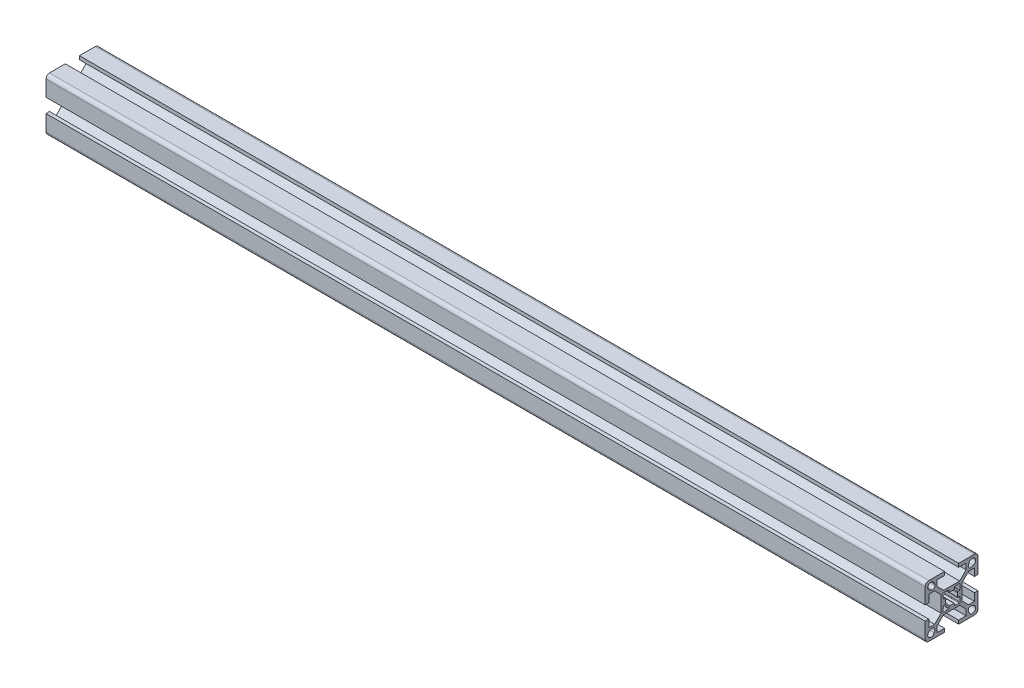
from build123d import *

# Parameters (mm, degrees)
BOSS_EXTRUDE1_DEPTH = 500


with BuildPart() as part:
    # Sketch1 → Boss-Extrude1 (new body)
    with BuildSketch(Plane(origin=(0, 0, 0), x_dir=(0, 0, -1), z_dir=(1, 0, 0))):
        with BuildLine():
            Line((-15, 13), (-15, 4))
            Line((-15, 4), (-13, 4))
            Line((-13, 4), (-13, 8.25))
            Line((-13, 8.25), (-9.664213562, 8.25))
            Line((-9.664213562, 8.25), (-6, 4.585786438))
            Line((-6, 4.585786438), (-6, -4.585786438))
            Line((-6, -4.585786438), (-9.664213562, -8.25))
            Line((-9.664213562, -8.25), (-13, -8.25))
            Line((-13, -8.25), (-13, -4))
            Line((-13, -4), (-15, -4))
            Line((-15, -4), (-15, -13))
            ThreePointArc((-15, -13), (-14.414213562, -14.414213562), (-13, -15))
            Line((-13, -15), (-4, -15))
            Line((-4, -15), (-4, -13))
            Line((-4, -13), (-8.25, -13))
            Line((-8.25, -13), (-8.25, -9.664213562))
            Line((-8.25, -9.664213562), (-4.585786438, -6))
            Line((-4.585786438, -6), (4.585786438, -6))
            Line((4.585786438, -6), (8.25, -9.664213562))
            Line((8.25, -9.664213562), (8.25, -13))
            Line((8.25, -13), (4, -13))
            Line((4, -13), (4, -15))
            Line((4, -15), (13, -15))
            ThreePointArc((13, -15), (14.414213562, -14.414213562), (15, -13))
            Line((15, -13), (15, -4))
            Line((15, -4), (13, -4))
            Line((13, -4), (13, -8.25))
            Line((13, -8.25), (9.664213562, -8.25))
            Line((9.664213562, -8.25), (6, -4.585786438))
            Line((6, -4.585786438), (6, 4.585786438))
            Line((6, 4.585786438), (9.664213562, 8.25))
            Line((9.664213562, 8.25), (13, 8.25))
            Line((13, 8.25), (13, 4))
            Line((13, 4), (15, 4))
            Line((15, 4), (15, 13))
            ThreePointArc((15, 13), (14.414213562, 14.414213562), (13, 15))
            Line((13, 15), (4, 15))
            Line((4, 15), (4, 13))
            Line((4, 13), (8.25, 13))
            Line((8.25, 13), (8.25, 9.664213562))
            Line((8.25, 9.664213562), (4.585786438, 6))
            Line((4.585786438, 6), (-4.585786438, 6))
            Line((-4.585786438, 6), (-8.25, 9.664213562))
            Line((-8.25, 9.664213562), (-8.25, 13))
            Line((-8.25, 13), (-4, 13))
            Line((-4, 13), (-4, 15))
            Line((-4, 15), (-13, 15))
            ThreePointArc((-13, 15), (-14.414213562, 14.414213562), (-15, 13))
        make_face()
        with BuildLine():
            Line((-9.539070071, 11.338915743), (-9.918883282, 12.361530981))
            ThreePointArc((-9.918883282, 12.361530981), (-13.043502884, 13.043502884), (-12.361530981, 9.918883282))
            Line((-12.361530981, 9.918883282), (-11.338915743, 9.539070071))
            ThreePointArc((-11.338915743, 9.539070071), (-9.861522369, 9.861522369), (-9.539070071, 11.338915743))
        make_face(mode=Mode.SUBTRACT)
        with BuildLine():
            Line((9.918883282, 12.361530981), (9.539070071, 11.338915743))
            ThreePointArc((9.539070071, 11.338915743), (9.861522369, 9.861522369), (11.338915743, 9.539070071))
            Line((11.338915743, 9.539070071), (12.361530981, 9.918883282))
            ThreePointArc((12.361530981, 9.918883282), (13.043502884, 13.043502884), (9.918883282, 12.361530981))
        make_face(mode=Mode.SUBTRACT)
        with BuildLine():
            Line((12.361530981, -9.918883282), (11.338915743, -9.539070071))
            ThreePointArc((11.338915743, -9.539070071), (9.861522369, -9.861522369), (9.539070071, -11.338915743))
            Line((9.539070071, -11.338915743), (9.918883282, -12.361530981))
            ThreePointArc((9.918883282, -12.361530981), (13.043502884, -13.043502884), (12.361530981, -9.918883282))
        make_face(mode=Mode.SUBTRACT)
        with BuildLine():
            Line((-11.338915743, -9.539070071), (-12.361530981, -9.918883282))
            ThreePointArc((-12.361530981, -9.918883282), (-13.043502884, -13.043502884), (-9.918883282, -12.361530981))
            Line((-9.918883282, -12.361530981), (-9.539070071, -11.338915743))
            ThreePointArc((-9.539070071, -11.338915743), (-9.861522369, -9.861522369), (-11.338915743, -9.539070071))
        make_face(mode=Mode.SUBTRACT)
        with BuildLine():
            Line((-4.8, -2.644433572), (-4.8, -4.5))
            ThreePointArc((-4.8, -4.5), (-4.712132034, -4.712132034), (-4.5, -4.8))
            Line((-4.5, -4.8), (-2.644433572, -4.8))
            ThreePointArc((-2.644433572, -4.8), (-2.615679847, -4.79861886), (-2.587190874, -4.794488155))
            Line((-2.587190874, -4.794488155), (-1.742757301, -4.630346896))
            ThreePointArc((-1.742757301, -4.630346896), (-1.568512625, -4.526682207), (-1.5, -4.335858741))
            Line((-1.5, -4.335858741), (-1.5, -3.5))
            ThreePointArc((-1.5, -3.5), (-1.374371458, -3.255879959), (-1.102702703, -3.216216216))
            ThreePointArc((-1.102702703, -3.216216216), (0, -3.4), (1.102702703, -3.216216216))
            ThreePointArc((1.102702703, -3.216216216), (1.374371458, -3.255879959), (1.5, -3.5))
            Line((1.5, -3.5), (1.5, -4.335858741))
            ThreePointArc((1.5, -4.335858741), (1.568512625, -4.526682207), (1.742757301, -4.630346896))
            Line((1.742757301, -4.630346896), (2.587190874, -4.794488155))
            ThreePointArc((2.587190874, -4.794488155), (2.615679847, -4.79861886), (2.644433572, -4.8))
            Line((2.644433572, -4.8), (4.5, -4.8))
            ThreePointArc((4.5, -4.8), (4.712132034, -4.712132034), (4.8, -4.5))
            Line((4.8, -4.5), (4.8, -2.644433572))
            ThreePointArc((4.8, -2.644433572), (4.79861886, -2.615679847), (4.794488155, -2.587190874))
            Line((4.794488155, -2.587190874), (4.630346896, -1.742757301))
            ThreePointArc((4.630346896, -1.742757301), (4.526682207, -1.568512625), (4.335858741, -1.5))
            Line((4.335858741, -1.5), (3.5, -1.5))
            ThreePointArc((3.5, -1.5), (3.255879959, -1.374371458), (3.216216216, -1.102702703))
            ThreePointArc((3.216216216, -1.102702703), (3.4, 0), (3.216216216, 1.102702703))
            ThreePointArc((3.216216216, 1.102702703), (3.255879959, 1.374371458), (3.5, 1.5))
            Line((3.5, 1.5), (4.335858741, 1.5))
            ThreePointArc((4.335858741, 1.5), (4.526682207, 1.568512625), (4.630346896, 1.742757301))
            Line((4.630346896, 1.742757301), (4.794488155, 2.587190874))
            ThreePointArc((4.794488155, 2.587190874), (4.79861886, 2.615679847), (4.8, 2.644433572))
            Line((4.8, 2.644433572), (4.8, 4.5))
            ThreePointArc((4.8, 4.5), (4.712132034, 4.712132034), (4.5, 4.8))
            Line((4.5, 4.8), (2.644433572, 4.8))
            ThreePointArc((2.644433572, 4.8), (2.615679847, 4.79861886), (2.587190874, 4.794488155))
            Line((2.587190874, 4.794488155), (1.742757301, 4.630346896))
            ThreePointArc((1.742757301, 4.630346896), (1.568512625, 4.526682207), (1.5, 4.335858741))
            Line((1.5, 4.335858741), (1.5, 3.5))
            ThreePointArc((1.5, 3.5), (1.374371458, 3.255879959), (1.102702703, 3.216216216))
            ThreePointArc((1.102702703, 3.216216216), (0, 3.4), (-1.102702703, 3.216216216))
            ThreePointArc((-1.102702703, 3.216216216), (-1.374371458, 3.255879959), (-1.5, 3.5))
            Line((-1.5, 3.5), (-1.5, 4.335858741))
            ThreePointArc((-1.5, 4.335858741), (-1.568512625, 4.526682207), (-1.742757301, 4.630346896))
            Line((-1.742757301, 4.630346896), (-2.587190874, 4.794488155))
            ThreePointArc((-2.587190874, 4.794488155), (-2.615679847, 4.79861886), (-2.644433572, 4.8))
            Line((-2.644433572, 4.8), (-4.5, 4.8))
            ThreePointArc((-4.5, 4.8), (-4.712132034, 4.712132034), (-4.8, 4.5))
            Line((-4.8, 4.5), (-4.8, 2.644433572))
            ThreePointArc((-4.8, 2.644433572), (-4.79861886, 2.615679847), (-4.794488155, 2.587190874))
            Line((-4.794488155, 2.587190874), (-4.630346896, 1.742757301))
            ThreePointArc((-4.630346896, 1.742757301), (-4.526682207, 1.568512625), (-4.335858741, 1.5))
            Line((-4.335858741, 1.5), (-3.5, 1.5))
            ThreePointArc((-3.5, 1.5), (-3.255879959, 1.374371458), (-3.216216216, 1.102702703))
            ThreePointArc((-3.216216216, 1.102702703), (-3.4, 0), (-3.216216216, -1.102702703))
            ThreePointArc((-3.216216216, -1.102702703), (-3.255879959, -1.374371458), (-3.5, -1.5))
            Line((-3.5, -1.5), (-4.335858741, -1.5))
            ThreePointArc((-4.335858741, -1.5), (-4.526682207, -1.568512625), (-4.630346896, -1.742757301))
            Line((-4.630346896, -1.742757301), (-4.794488155, -2.587190874))
            ThreePointArc((-4.794488155, -2.587190874), (-4.79861886, -2.615679847), (-4.8, -2.644433572))
        make_face(mode=Mode.SUBTRACT)
    extrude(amount=BOSS_EXTRUDE1_DEPTH)


solid = part.part
